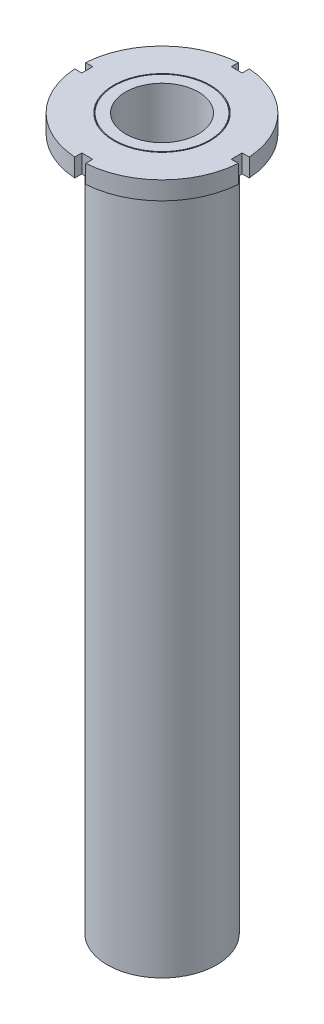
from build123d import *

# Parameters (mm, degrees)
SKETCH1_R           = 15
BOSS_EXTRUDE1_DEPTH = 190
BOSS_EXTRUDE2_DEPTH = 5
SKETCH3_R           = 13.25
SKETCH3_R_2         = 13
CUT_EXTRUDE1_DEPTH  = 0.5
SKETCH4_R           = 10
CUT_EXTRUDE2_DEPTH  = 198.567709912
SKETCH5_R           = 1.5
BOSS_EXTRUDE3_DEPTH = 10.35


with BuildPart() as part:
    # Sketch1 → Boss-Extrude1 (new body)
    with BuildSketch(Plane(origin=(0, 0, 0), x_dir=(1, 0, 0), z_dir=(0, 1, 0))):
        with Locations(Location((0, 0, 0), (0, 0, 270))):
            Circle(SKETCH1_R)
    extrude(amount=BOSS_EXTRUDE1_DEPTH)

    # Sketch2 → Boss-Extrude2 (add)
    with BuildSketch(Plane(origin=(0, 190, 0), x_dir=(1, 0, 0), z_dir=(0, 1, 0))):
        with BuildLine():
            Line((-1.5, 20.5), (1.5, 20.5))
            Line((1.5, 20.5), (1.5, 22.449944321))
            ThreePointArc((1.5, 22.449944321), (15.909902577, 15.909902577), (22.449944321, 1.5))
            Line((22.449944321, 1.5), (20.5, 1.5))
            Line((20.5, 1.5), (20.5, -1.5))
            Line((20.5, -1.5), (22.449944321, -1.5))
            ThreePointArc((22.449944321, -1.5), (15.909902577, -15.909902577), (1.5, -22.449944321))
            Line((1.5, -22.449944321), (1.5, -20.5))
            Line((1.5, -20.5), (-1.5, -20.5))
            Line((-1.5, -20.5), (-1.5, -22.449944321))
            ThreePointArc((-1.5, -22.449944321), (-15.909902577, -15.909902577), (-22.449944321, -1.5))
            Line((-22.449944321, -1.5), (-20.5, -1.5))
            Line((-20.5, -1.5), (-20.5, 1.5))
            Line((-20.5, 1.5), (-22.449944321, 1.5))
            ThreePointArc((-22.449944321, 1.5), (-15.909902577, 15.909902577), (-1.5, 22.449944321))
            Line((-1.5, 22.449944321), (-1.5, 20.5))
        make_face()
    extrude(amount=BOSS_EXTRUDE2_DEPTH)

    # Sketch3 → Cut-Extrude1 (cut)
    with BuildSketch(Plane(origin=(0, 195, 0), x_dir=(1, 0, 0), z_dir=(0, 1, 0))):
        with Locations(Location((0, 0, 0), (0, 0, 270))):
            Circle(SKETCH3_R)
        with Locations(Location((0, 0, 0), (0, 0, 270))):
            Circle(SKETCH3_R_2, mode=Mode.SUBTRACT)
    extrude(amount=-CUT_EXTRUDE1_DEPTH, mode=Mode.SUBTRACT)

    # Sketch4 → Cut-Extrude2 (cut, through all)
    with BuildSketch(Plane(origin=(0, 195, 0), x_dir=(1, 0, 0), z_dir=(0, 1, 0))):
        with Locations(Location((0, 0, 0), (0, 0, 270))):
            Circle(SKETCH4_R)
    extrude(amount=-CUT_EXTRUDE2_DEPTH, mode=Mode.SUBTRACT)

    # Sketch5 → Boss-Extrude3 (add, symmetric)
    with BuildSketch(Plane(origin=(0, 0, 0), x_dir=(0, 0, -1), z_dir=(1, 0, 0))):
        with Locations(Location((0, 180, 0), (0, 0, 180))):
            Circle(SKETCH5_R)
    extrude(amount=BOSS_EXTRUDE3_DEPTH, both=True)


solid = part.part
